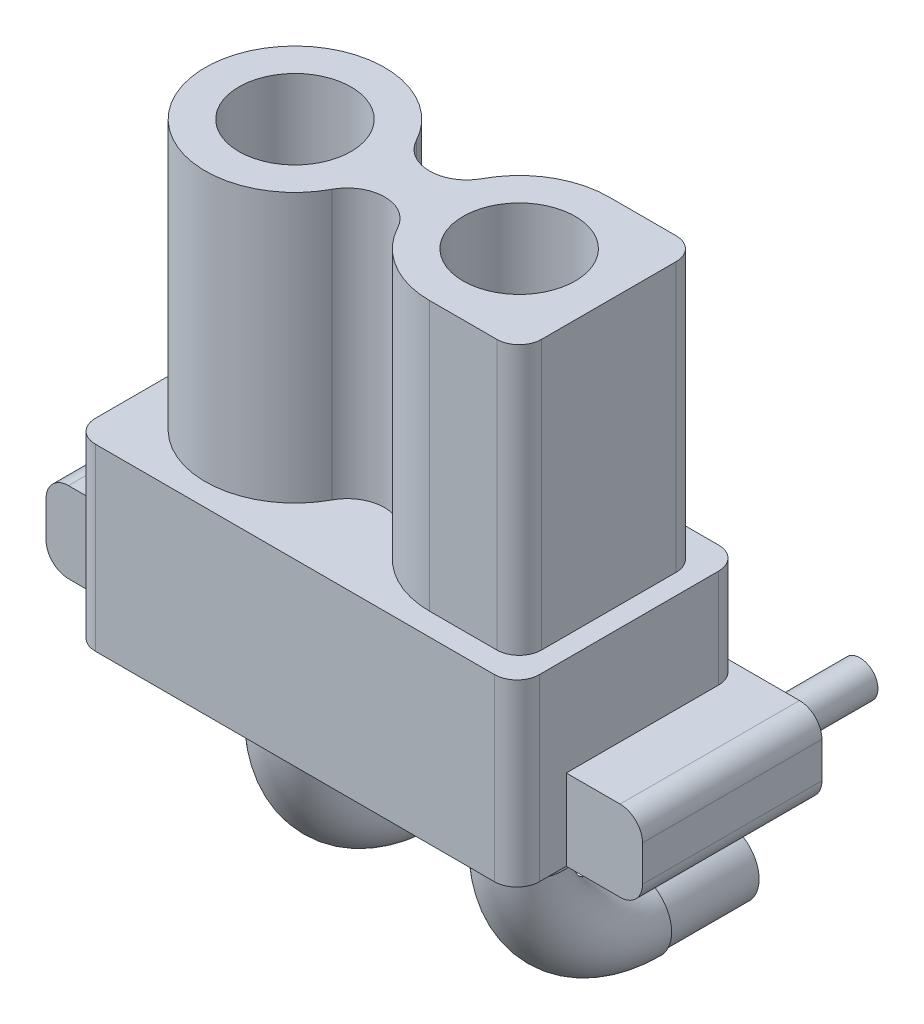
from build123d import *
from build123d.topology import SkipClean

# Parameters (mm, degrees)
SKETCH_1_R             = 0.75
EXTRUDE_1_DEPTH        = 2
SKETCH_2_R             = 0.8
SKETCH_4_R             = 1
EXTRUDE_2_DEPTH        = 1.5
SKETCH_5_W             = 9.9
SKETCH_5_H             = 5
EXTRUDE_3_DEPTH        = 4
SKETCH_8_R             = 0.4
EXTRUDE_5_DEPTH        = 2
EXTRUDE_5_2_DEPTH      = 2
SKETCH_9_W             = 2.7
SKETCH_9_H             = 1.8
EXTRUDE_6_DEPTH        = 4
EXTRUDE_4_DEPTH        = 6
SKETCH_7_R             = 1.25
CUT_EXTRUDE_1_DEPTH    = 6
PATTERN_LINEAR_1_COUNT = 2
PATTERN_LINEAR_1_PITCH = 5
CUT_EXTRUDE_START      = -6
CUT_EXTRUDE_2_DEPTH    = 6
FILLET_1_R             = 0.5
FILLET_2_R             = 0.5
FILLET_3_R             = 0.5


with BuildPart() as part:
    # ｽｹｯﾁ1 → ﾎﾞｽ - 押し出し1 (new body)
    with BuildSketch(Plane.XY):
        Circle(SKETCH_1_R)
    extrude_1 = extrude(amount=-EXTRUDE_1_DEPTH)

    # ｽｲｰﾌﾟ1: sweep along a path in ｽｹｯﾁ3
    with BuildLine(Plane(origin=(0, 0, 0), x_dir=(0, 0, -1), z_dir=(1, 0, 0))) as sweep_1_path:
        ThreePointArc((0, 0), (-1.838477631, 0.761522369), (-2.6, 2.6))
    # ｽｹｯﾁ2 → ｽｲｰﾌﾟ1 (sweep)
    with BuildSketch(Plane.XY):
        Circle(SKETCH_2_R)
    sweep_1 = sweep(path=sweep_1_path.line)

    # ｽｹｯﾁ4 → ﾎﾞｽ - 押し出し2 (add)
    with BuildSketch(Plane(origin=(0, 2.6, 0), x_dir=(1, 0, 0), z_dir=(0, 1, 0))):
        with Locations(Location((0, -2.6, 0), (0, 0, 270))):
            Circle(SKETCH_4_R)
    extrude_2 = extrude(amount=EXTRUDE_2_DEPTH)

    # ｽｹｯﾁ5 → ﾎﾞｽ - 押し出し3 (add)
    with BuildSketch(Plane(origin=(0, 4.1, 0), x_dir=(1, 0, 0), z_dir=(0, 1, 0))):
        with Locations((2.5, -2.6)):
            Rectangle(SKETCH_5_W, SKETCH_5_H)
    extrude(amount=EXTRUDE_3_DEPTH)



with BuildPart() as body_2:
    # ｽｹｯﾁ8 → ﾎﾞｽ - 押し出し5 (new body)
    with BuildSketch(Plane.XY):
        with Locations((-3, 5)):
            Circle(SKETCH_8_R)
    extrude(amount=-EXTRUDE_5_DEPTH)


with BuildPart() as body_3:
    # ｽｹｯﾁ8 → Extrude 5 2 (new body)
    with BuildSketch(Plane.XY):
        with Locations((8, 5)):
            Circle(SKETCH_8_R)
    extrude(amount=-EXTRUDE_5_2_DEPTH)


with BuildPart() as part_1:
    add(part.part)

    add(body_2.part)  # ﾎﾞｽ - 押し出し6 merges body 2

    add(body_3.part)  # ﾎﾞｽ - 押し出し6 merges body 3
    # ｽｹｯﾁ9 → ﾎﾞｽ - 押し出し6 (add)
    with BuildSketch(Plane.XY):
        with Locations((-2.8, 5)):
            Rectangle(SKETCH_9_W, SKETCH_9_H)
        with Locations((7.8, 5)):
            Rectangle(SKETCH_9_W, SKETCH_9_H)
    extrude(amount=EXTRUDE_6_DEPTH)

    # ｽｹｯﾁ6 → ﾎﾞｽ - 押し出し4 (add)
    with BuildSketch(Plane(origin=(0, 8.1, 0), x_dir=(1, 0, 0), z_dir=(0, 1, 0))):
        with BuildLine():
            Line((0, -0.6), (7, -0.6))
            Line((7, -0.6), (7, -4.6))
            Line((7, -4.6), (0, -4.6))
            ThreePointArc((0, -4.6), (-2, -2.6), (0, -0.6))
        make_face()
    extrude(amount=EXTRUDE_4_DEPTH)

    # ｽｹｯﾁ7 → ｶｯﾄ - 押し出し1 (cut)
    with BuildSketch(Plane(origin=(0, 14.1, 0), x_dir=(1, 0, 0), z_dir=(0, 1, 0))):
        with Locations(Location((0, -2.6, 0), (0, 0, 270))):
            Circle(SKETCH_7_R)
    cut_extrude_1 = extrude(amount=-CUT_EXTRUDE_1_DEPTH, mode=Mode.SUBTRACT)

    # 直線ﾊﾟﾀｰﾝ1: ﾎﾞｽ - 押し出し1, ｽｲｰﾌﾟ1, ﾎﾞｽ - 押し出し2, ｶｯﾄ - 押し出し1 ×2
    with Locations(*[(i * PATTERN_LINEAR_1_PITCH, 0, 0) for i in range(1, PATTERN_LINEAR_1_COUNT)]):
        add(extrude_1)
        add(sweep_1)
        add(extrude_2)
        add(cut_extrude_1, mode=Mode.SUBTRACT)

    # ｽｹｯﾁ10 → ｶｯﾄ - 押し出し2 (cut)
    with SkipClean():  # the faces are left unmerged after this step: merging them gives an invalid solid
        with BuildSketch(Plane(origin=(0, 14.1, 0), x_dir=(1, 0, 0), z_dir=(0, 1, 0)).offset(CUT_EXTRUDE_START)):
            with BuildLine():
                Line((0, -0.6), (5, -0.6))
                ThreePointArc((5, -0.6), (3.971008489, -0.885014149), (3.235294118, -1.658823529))
                ThreePointArc((3.235294118, -1.658823529), (2.5, -2.1), (1.764705882, -1.658823529))
                ThreePointArc((1.764705882, -1.658823529), (1.028991511, -0.885014149), (0, -0.6))
            make_face()
        cut_extrude_2 = extrude(amount=CUT_EXTRUDE_2_DEPTH, mode=Mode.SUBTRACT)

    # ﾐﾗｰ1: ｶｯﾄ - 押し出し2 across plane
    with SkipClean():  # the faces are left unmerged after this step: merging them gives an invalid solid
        add(cut_extrude_2.mirror(Plane.XY.offset(2.6)), mode=Mode.SUBTRACT)

    # ﾌｨﾚｯﾄ1
    fillet_1_edges = [part_1.edges().sort_by_distance(p)[0] for p in [
        (-4.15, 4.1, 2),
        (-4.15, 5.9, 2),
        (9.15, 5.9, 2),
        (9.15, 4.1, 2),
    ]]
    fillet(fillet_1_edges, radius=FILLET_1_R)

    # ﾌｨﾚｯﾄ2
    fillet_2_edges = [part_1.edges().sort_by_distance(p)[0] for p in [
        (7.45, 7, 0.1),
        (-2.45, 7, 0.1),
        (-2.45, 6.1, 5.1),
        (7.45, 6.1, 5.1),
    ]]
    fillet(fillet_2_edges, radius=FILLET_2_R)

    # ﾌｨﾚｯﾄ3
    fillet_3_edges = [part_1.edges().sort_by_distance(p)[0] for p in [
        (7, 11.1, 4.6),
        (7, 11.1, 0.6),
    ]]
    fillet(fillet_3_edges, radius=FILLET_3_R)


solid = part_1.part
